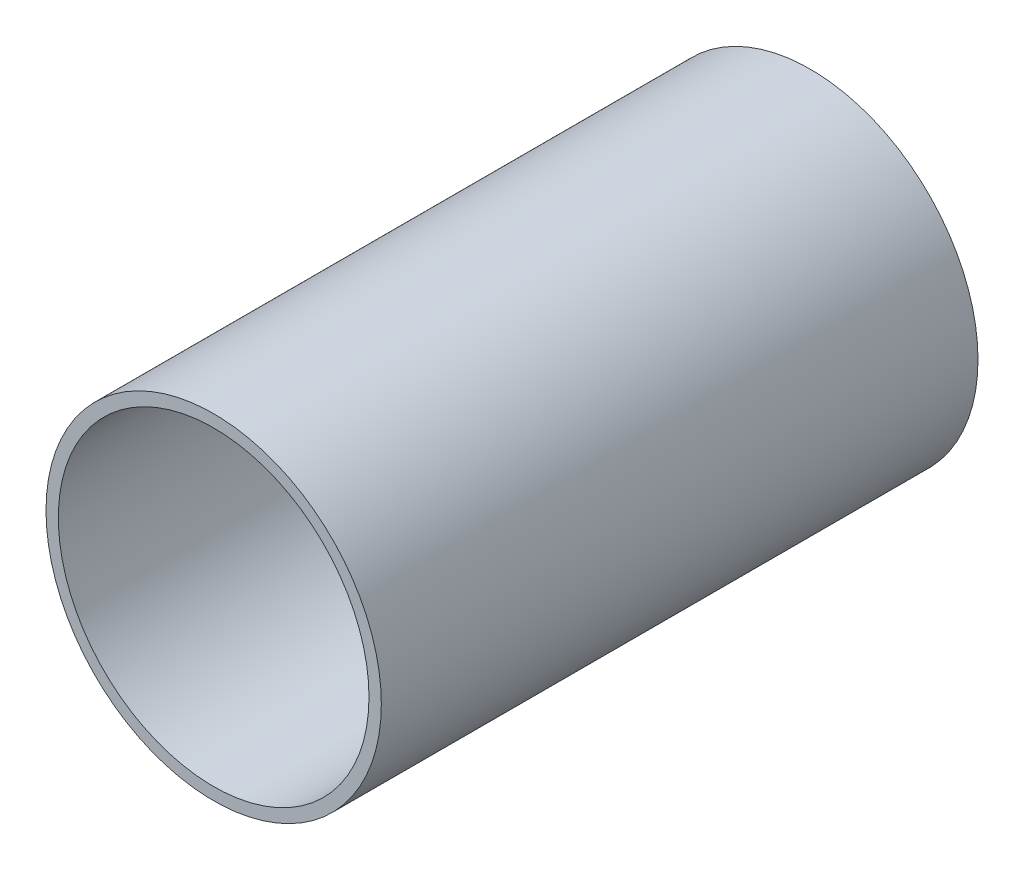
from build123d import *

# Parameters (mm, degrees)
RING_1MM_R          = 68
RING_1MM_R_2        = 63
BOSS_EXTRUDE1_DEPTH = 240
CUT_EXTRUDE2_DEPTH  = 240


with BuildPart() as part:
    # Sketch1 → Revolve1 (revolve)
    with BuildSketch(Plane(origin=(0, 0, 0), x_dir=(-1, 0, 0), z_dir=(0, 1, 0)), mode=Mode.PRIVATE) as revolve1_sk:
        Polygon((19.5, 0), (19.25, 8), (16.5, 9.5), (16.5, 20), (19.5, 20), (22, 2), (68, 2), (68, 0), align=None)
    revolve(revolve1_sk.sketch.rotate(Axis((0, 0, 20), (0, 0, -1)), 180), axis=Axis((0, 0, 20), (0, 0, -1)))

    # ring-1mm → Boss-Extrude1 (add)
    with BuildSketch(Plane.XY.offset(2)):
        Circle(RING_1MM_R)
        Circle(RING_1MM_R_2, mode=Mode.SUBTRACT)
    extrude(amount=BOSS_EXTRUDE1_DEPTH)

    # Sketch3-base-openings → Cut-Extrude2 (cut)
    with BuildSketch(Plane.XY.offset(2)):
        with BuildLine():
            Line((29.095389312, 5.13030215), (48.49231552, 8.550503583))
            ThreePointArc((48.49231552, 8.550503583), (58.682408883, 0), (48.49231552, -8.550503583))
            Line((48.49231552, -8.550503583), (29.095389312, -5.13030215))
            ThreePointArc((29.095389312, -5.13030215), (24.79055467, 0), (29.095389312, 5.13030215))
        make_face()
        with BuildLine():
            Line((27.762497352, -10.104722665), (46.27082892, -16.841204442))
            ThreePointArc((46.27082892, -16.841204442), (50.820456848, -29.341204442), (37.720325337, -31.651111078))
            Line((37.720325337, -31.651111078), (22.632195202, -18.990666647))
            ThreePointArc((22.632195202, -18.990666647), (21.469250118, -12.395277335), (27.762497352, -10.104722665))
        make_face()
        with BuildLine():
            Line((18.990666647, -22.632195202), (31.651111078, -37.720325337))
            ThreePointArc((31.651111078, -37.720325337), (29.341204442, -50.820456848), (16.841204442, -46.27082892))
            Line((16.841204442, -46.27082892), (10.104722665, -27.762497352))
            ThreePointArc((10.104722665, -27.762497352), (12.395277335, -21.469250118), (18.990666647, -22.632195202))
        make_face()
        with BuildLine():
            Line((5.13030215, -29.095389312), (8.550503583, -48.49231552))
            ThreePointArc((8.550503583, -48.49231552), (0, -58.682408883), (-8.550503583, -48.49231552))
            Line((-8.550503583, -48.49231552), (-5.13030215, -29.095389312))
            ThreePointArc((-5.13030215, -29.095389312), (0, -24.79055467), (5.13030215, -29.095389312))
        make_face()
        with BuildLine():
            Line((-10.104722665, -27.762497352), (-16.841204442, -46.27082892))
            ThreePointArc((-16.841204442, -46.27082892), (-29.341204442, -50.820456848), (-31.651111078, -37.720325337))
            Line((-31.651111078, -37.720325337), (-18.990666647, -22.632195202))
            ThreePointArc((-18.990666647, -22.632195202), (-12.395277335, -21.469250118), (-10.104722665, -27.762497352))
        make_face()
        with BuildLine():
            Line((-22.632195202, -18.990666647), (-37.720325337, -31.651111078))
            ThreePointArc((-37.720325337, -31.651111078), (-50.820456848, -29.341204442), (-46.27082892, -16.841204442))
            Line((-46.27082892, -16.841204442), (-27.762497352, -10.104722665))
            ThreePointArc((-27.762497352, -10.104722665), (-21.469250118, -12.395277335), (-22.632195202, -18.990666647))
        make_face()
        with BuildLine():
            Line((-29.095389312, -5.13030215), (-48.49231552, -8.550503583))
            ThreePointArc((-48.49231552, -8.550503583), (-58.682408883, 0), (-48.49231552, 8.550503583))
            Line((-48.49231552, 8.550503583), (-29.095389312, 5.13030215))
            ThreePointArc((-29.095389312, 5.13030215), (-24.79055467, 0), (-29.095389312, -5.13030215))
        make_face()
        with BuildLine():
            Line((-27.762497352, 10.104722665), (-46.27082892, 16.841204442))
            ThreePointArc((-46.27082892, 16.841204442), (-50.820456848, 29.341204442), (-37.720325337, 31.651111078))
            Line((-37.720325337, 31.651111078), (-22.632195202, 18.990666647))
            ThreePointArc((-22.632195202, 18.990666647), (-21.469250118, 12.395277335), (-27.762497352, 10.104722665))
        make_face()
        with BuildLine():
            Line((-18.990666647, 22.632195202), (-31.651111078, 37.720325337))
            ThreePointArc((-31.651111078, 37.720325337), (-29.341204442, 50.820456848), (-16.841204442, 46.27082892))
            Line((-16.841204442, 46.27082892), (-10.104722665, 27.762497352))
            ThreePointArc((-10.104722665, 27.762497352), (-12.395277335, 21.469250118), (-18.990666647, 22.632195202))
        make_face()
        with BuildLine():
            Line((-5.13030215, 29.095389312), (-8.550503583, 48.49231552))
            ThreePointArc((-8.550503583, 48.49231552), (0, 58.682408883), (8.550503583, 48.49231552))
            Line((8.550503583, 48.49231552), (5.13030215, 29.095389312))
            ThreePointArc((5.13030215, 29.095389312), (0, 24.79055467), (-5.13030215, 29.095389312))
        make_face()
        with BuildLine():
            Line((10.104722665, 27.762497352), (16.841204442, 46.27082892))
            ThreePointArc((16.841204442, 46.27082892), (29.341204442, 50.820456848), (31.651111078, 37.720325337))
            Line((31.651111078, 37.720325337), (18.990666647, 22.632195202))
            ThreePointArc((18.990666647, 22.632195202), (12.395277335, 21.469250118), (10.104722665, 27.762497352))
        make_face()
        with BuildLine():
            Line((22.632195202, 18.990666647), (37.720325337, 31.651111078))
            ThreePointArc((37.720325337, 31.651111078), (50.820456848, 29.341204442), (46.27082892, 16.841204442))
            Line((46.27082892, 16.841204442), (27.762497352, 10.104722665))
            ThreePointArc((27.762497352, 10.104722665), (21.469250118, 12.395277335), (22.632195202, 18.990666647))
        make_face()
    extrude(amount=-CUT_EXTRUDE2_DEPTH, mode=Mode.SUBTRACT)


solid = part.part
